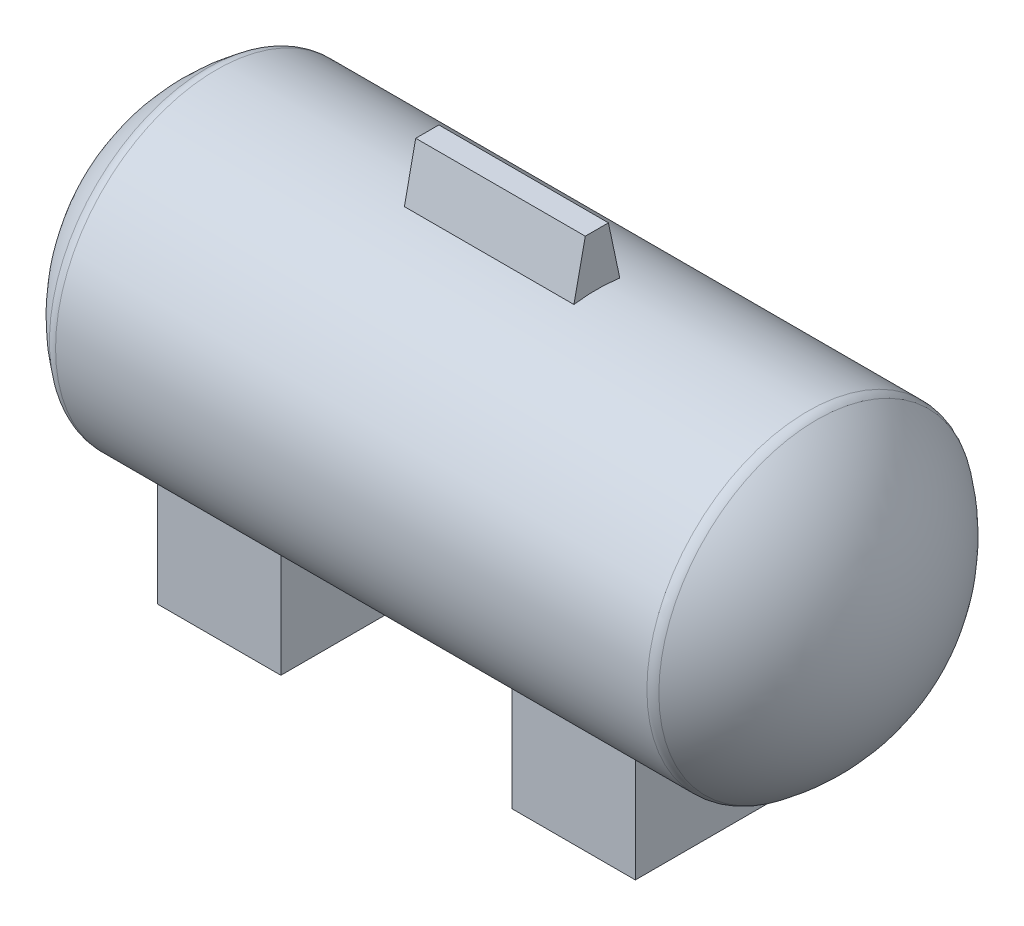
from build123d import *

# Parameters (mm, degrees)
SKETCH_3_W          = 8
SKETCH_3_H          = 15
EXTRUDE_1_DEPTH     = 14
SKETCH_4_R          = 1.5
CUT_EXTRUDE_1_DEPTH = 10
FILLET_1_R          = 1
EXTRUDE_2_DEPTH     = 5.5


with BuildPart() as part:
    # ｽｹｯﾁ1 → 回転2 (revolve)
    with BuildSketch(Plane.XY):
        with BuildLine():
            Line((-19.5, 10.435516279), (19.5, 10.435516279))
            ThreePointArc((19.5, 10.435516279), (23.540844472, 5.898092912), (25, 0))
            Line((25, 0), (-25, 0))
            ThreePointArc((-25, 0), (-23.540844472, 5.898092912), (-19.5, 10.435516279))
        make_face()
    revolve(axis=Axis((-19.5, 0, 0), (1, 0, 0)))

    # ｽｹｯﾁ3 → ﾎﾞｽ - 押し出し1 (add)
    with BuildSketch(Plane(origin=(0, 0, 0), x_dir=(1, 0, 0), z_dir=(0, 1, 0))):
        with Locations((-11.5, 0)):
            Rectangle(SKETCH_3_W, SKETCH_3_H)
        with Locations((11.5, 0)):
            Rectangle(SKETCH_3_W, SKETCH_3_H)
    extrude(amount=-EXTRUDE_1_DEPTH)

    # ｽｹｯﾁ4 → ｶｯﾄ - 押し出し1 (cut)
    with BuildSketch(Plane(origin=(0, -14, 0), x_dir=(-1, 0, 0), z_dir=(0, -1, 0))):
        with Locations(Location((-11.5, 0, 0), (0, 0, 90))):
            Circle(SKETCH_4_R)
        with Locations(Location((11.5, 0, 0), (0, 0, 90))):
            Circle(SKETCH_4_R)
    extrude(amount=-CUT_EXTRUDE_1_DEPTH, mode=Mode.SUBTRACT)

    # ﾌｨﾚｯﾄ1
    fillet_1_edges = [part.edges().sort_by_distance(p)[0] for p in [
        (-19.5, -10.435516279, 0),
        (19.5, -10.435516279, 0),
    ]]
    fillet(fillet_1_edges, radius=FILLET_1_R)

    # ｽｹｯﾁ5 → ﾎﾞｽ - 押し出し2 (add, symmetric)
    with BuildSketch(Plane(origin=(0, 0, 0), x_dir=(0, 0, -1), z_dir=(1, 0, 0))):
        Polygon((-1.6, 9.8), (1.6, 9.8), (0.75, 13.8), (-0.75, 13.8), align=None)
    extrude(amount=EXTRUDE_2_DEPTH, both=True)


solid = part.part
